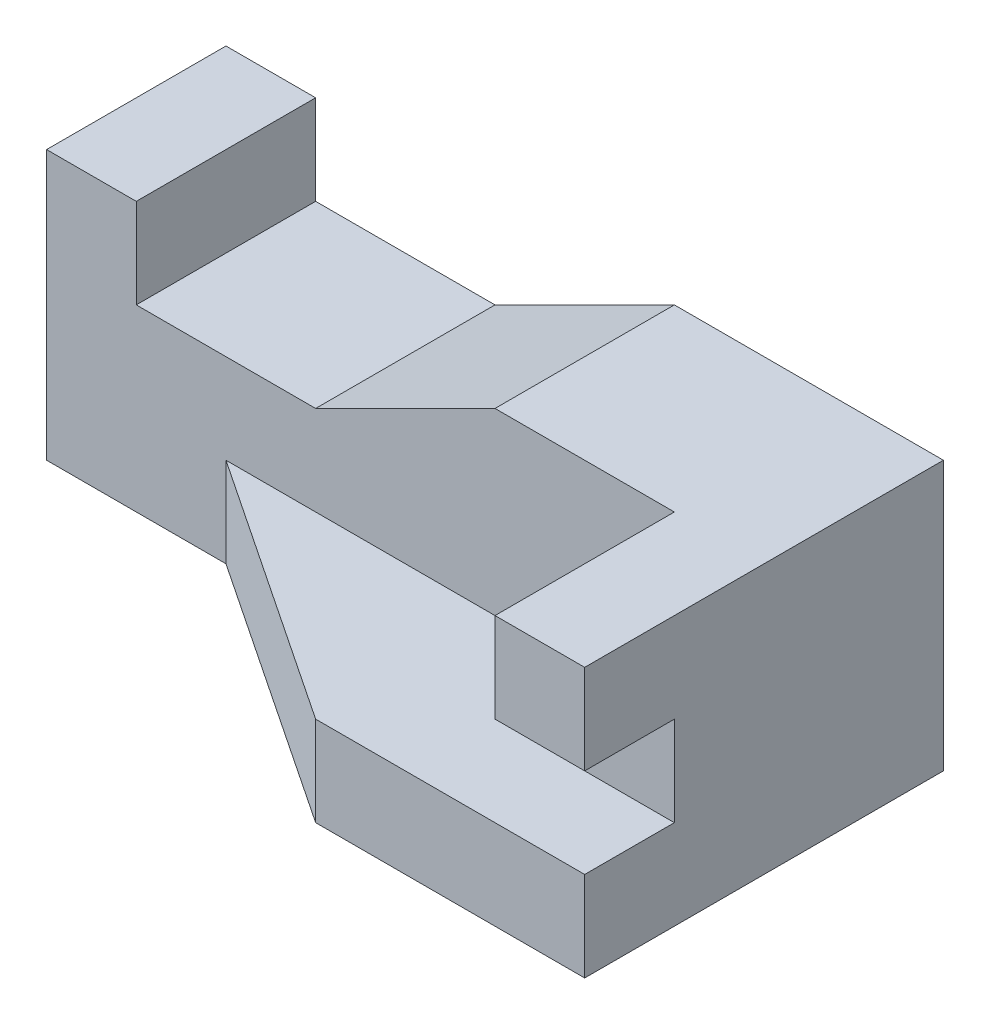
from build123d import *

# Parameters (mm, degrees)
BOSS_EXTRUDE1_DEPTH = 20
SKETCH2_W           = 30
SKETCH2_H           = 10
BOSS_EXTRUDE2_DEPTH = 20
BOSS_EXTRUDE3_DEPTH = 10
SKETCH4_W           = 10
SKETCH4_H           = 20
BOSS_EXTRUDE4_DEPTH = 10
SKETCH5_W           = 10
SKETCH5_H           = 10
BOSS_EXTRUDE5_DEPTH = 10


with BuildPart() as part:
    # Sketch1 → Boss-Extrude1 (new body)
    with BuildSketch(Plane.XY):
        Polygon((-29.033595627, 12.701314612), (-29.033595627, 2.701314612), (-9.033595627, 2.701314612), (10.966404373, 12.701314612), (40.966404373, 12.701314612), (40.966404373, -17.298685388), (-39.033595627, -17.298685388), (-39.033595627, 12.701314612), align=None)
    extrude(amount=BOSS_EXTRUDE1_DEPTH)

    # Sketch2 → Boss-Extrude2 (add)
    with BuildSketch(Plane.XY.offset(20)):
        with Locations((25.966404373, -12.298685388)):
            Rectangle(SKETCH2_W, SKETCH2_H)
    extrude(amount=BOSS_EXTRUDE2_DEPTH)

    # Sketch3 → Boss-Extrude3 (add)
    with BuildSketch(Plane(origin=(0, -17.298685388, 0), x_dir=(-1, 0, 0), z_dir=(0, -1, 0))):
        Polygon((-10.966404373, -40), (19.033595627, -20), (-10.966404373, -20), align=None)
    extrude(amount=-BOSS_EXTRUDE3_DEPTH)

    # Sketch4 → Boss-Extrude4 (add)
    with BuildSketch(Plane.XY.offset(20)):
        with Locations((35.966404373, 2.701314612)):
            Rectangle(SKETCH4_W, SKETCH4_H)
    extrude(amount=BOSS_EXTRUDE4_DEPTH)

    # Sketch5 → Boss-Extrude5 (add)
    with BuildSketch(Plane.XY.offset(30)):
        with Locations((35.966404373, 7.701314612)):
            Rectangle(SKETCH5_W, SKETCH5_H)
    extrude(amount=BOSS_EXTRUDE5_DEPTH)


solid = part.part
